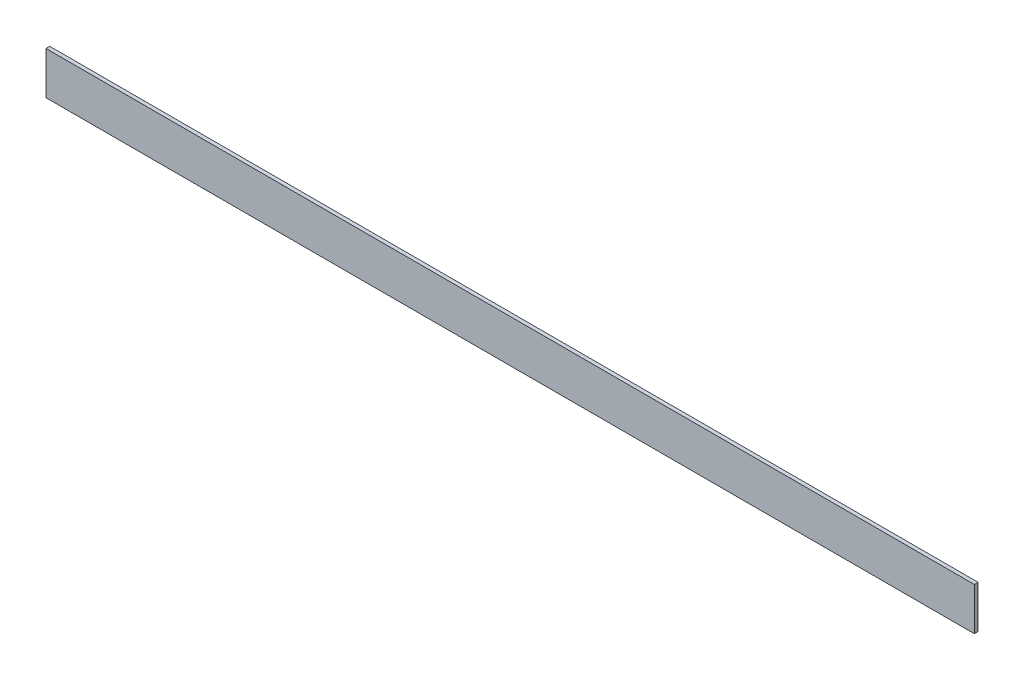
from build123d import *

# Parameters (mm, degrees)
SKETCH1_W           = 2500
SKETCH1_H           = 115
BOSS_EXTRUDE1_DEPTH = 10


with BuildPart() as part:
    # Sketch1 → Boss-Extrude1 (new body)
    with BuildSketch(Plane.XY):
        with Locations((1250, 57.5)):
            Rectangle(SKETCH1_W, SKETCH1_H)
    extrude(amount=BOSS_EXTRUDE1_DEPTH)


solid = part.part
